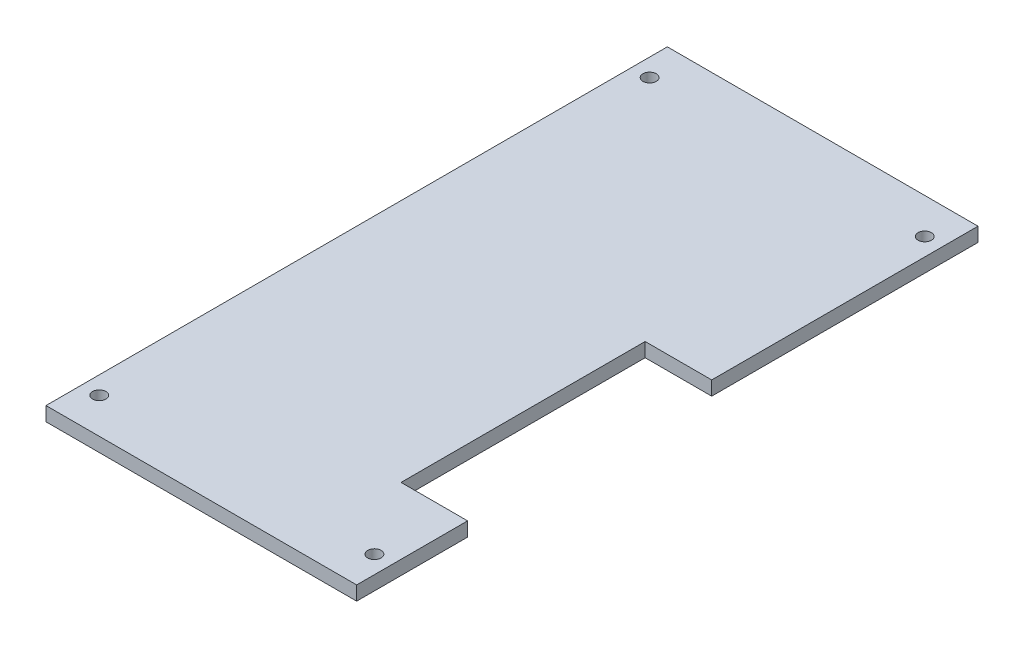
from build123d import *

# Parameters (mm, degrees)
SKETCH1_R           = 1.5
BOSS_EXTRUDE1_DEPTH = 3.175


with BuildPart() as part:
    # Sketch1 → Boss-Extrude1 (new body)
    with BuildSketch(Plane(origin=(0, 0, 0), x_dir=(1, 0, 0), z_dir=(0, 1, 0))):
        Polygon((35, 9.999999982), (20, 9.999999982), (20, -45), (35, -45), (35, -70), (-35, -70), (-35, 70), (35, 70), align=None)
        with Locations(Location((31, -62, 0), (0, 0, 270))):
            Circle(SKETCH1_R, mode=Mode.SUBTRACT)
        with Locations(Location((-31, -62, 0), (0, 0, 90))):
            Circle(SKETCH1_R, mode=Mode.SUBTRACT)
        with Locations(Location((-31, 62, 0), (0, 0, 270))):
            Circle(SKETCH1_R, mode=Mode.SUBTRACT)
        with Locations(Location((31, 62, 0), (0, 0, 90))):
            Circle(SKETCH1_R, mode=Mode.SUBTRACT)
    extrude(amount=BOSS_EXTRUDE1_DEPTH)


solid = part.part
